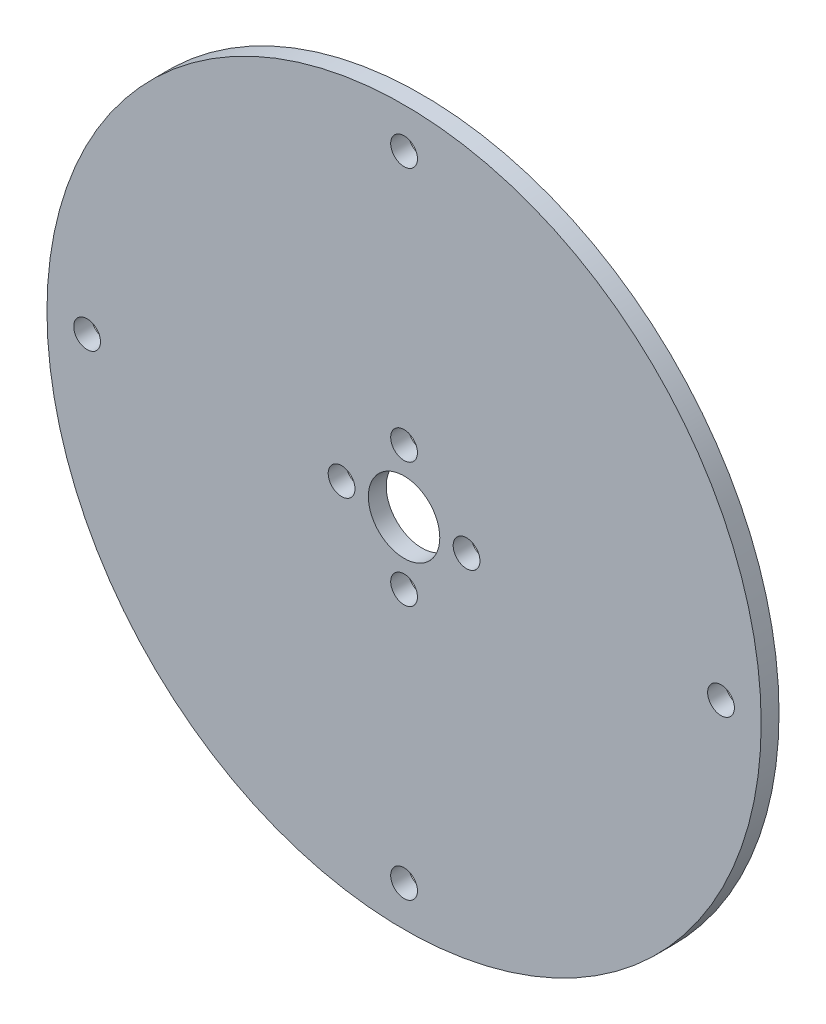
from build123d import *

# Parameters (mm, degrees)
SKETCH_1_R      = 40
SKETCH_1_R_2    = 1.5
SKETCH_1_R_3    = 4
EXTRUDE_1_DEPTH = 2


with BuildPart() as part:
    # 草图1 → 凸台-拉伸1 (new body)
    with BuildSketch(Plane.XY):
        Circle(SKETCH_1_R)
        with Locations((0, 7)):
            Circle(SKETCH_1_R_2, mode=Mode.SUBTRACT)
        with Locations((7, 0)):
            Circle(SKETCH_1_R_2, mode=Mode.SUBTRACT)
        with Locations((0, -7)):
            Circle(SKETCH_1_R_2, mode=Mode.SUBTRACT)
        with Locations((-7, 0)):
            Circle(SKETCH_1_R_2, mode=Mode.SUBTRACT)
        with Locations((0, 35.5)):
            Circle(SKETCH_1_R_2, mode=Mode.SUBTRACT)
        with Locations((35.5, 0)):
            Circle(SKETCH_1_R_2, mode=Mode.SUBTRACT)
        with Locations((0, -35.5)):
            Circle(SKETCH_1_R_2, mode=Mode.SUBTRACT)
        with Locations((-35.5, 0)):
            Circle(SKETCH_1_R_2, mode=Mode.SUBTRACT)
        Circle(SKETCH_1_R_3, mode=Mode.SUBTRACT)
    extrude(amount=EXTRUDE_1_DEPTH)


solid = part.part
